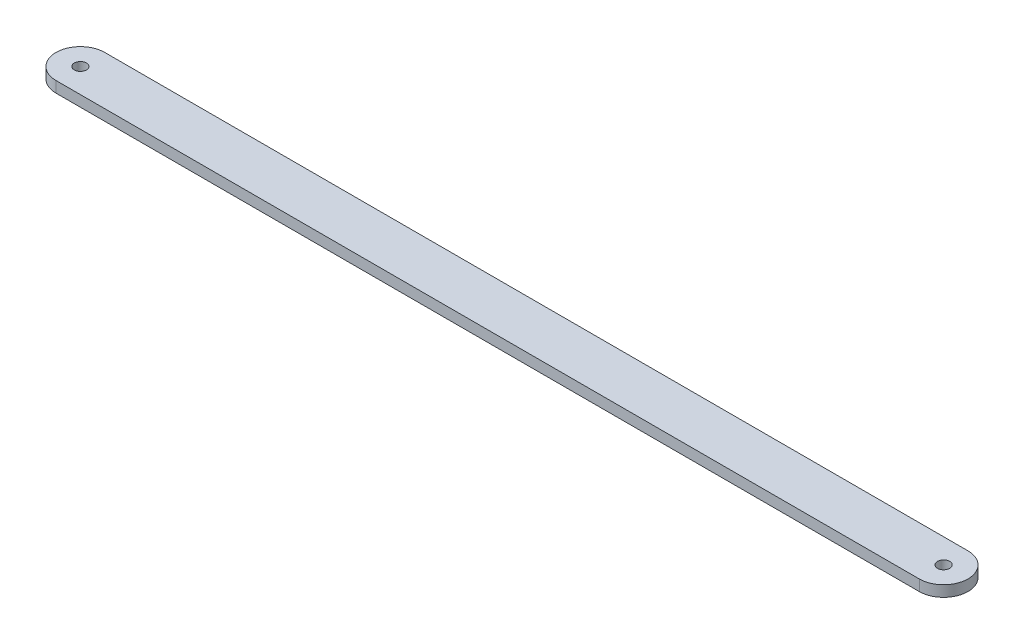
from build123d import *

# Parameters (mm, degrees)
SKETCH_1_R      = 2.5
EXTRUDE_1_DEPTH = 4.5


with BuildPart() as part:
    # 草圖1 → 填料-伸長1 (new body)
    with BuildSketch(Plane(origin=(0, 0, 0), x_dir=(1, 0, 0), z_dir=(0, 1, 0))):
        with BuildLine():
            Line((-177.245, 10), (177.245, 10))
            ThreePointArc((177.245, 10), (187.245, 0), (177.245, -10))
            Line((177.245, -10), (-177.245, -10))
            ThreePointArc((-177.245, -10), (-187.245, 0), (-177.245, 10))
        make_face()
        with Locations(Location((-177.245, 0, 0), (0, 0, 270))):
            Circle(SKETCH_1_R, mode=Mode.SUBTRACT)
        with Locations(Location((177.245, 0, 0), (0, 0, 270))):
            Circle(SKETCH_1_R, mode=Mode.SUBTRACT)
    extrude(amount=EXTRUDE_1_DEPTH)


solid = part.part
